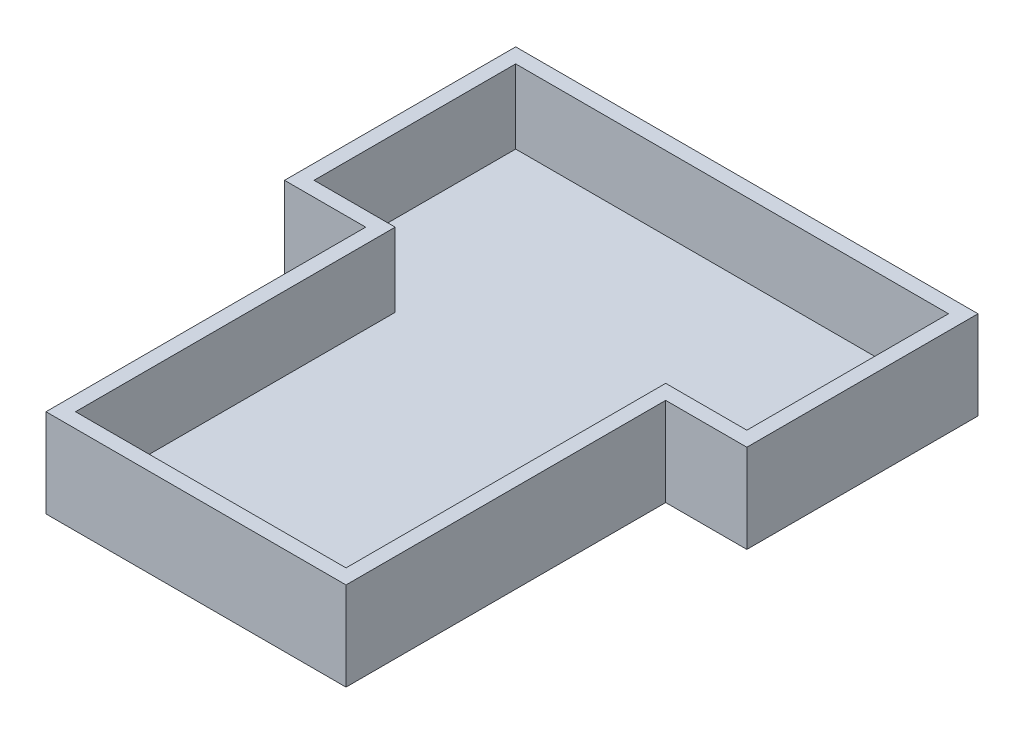
from build123d import *

# Parameters (mm, degrees)
BOSS_EXTRUDE1_DEPTH = 15
SHELL1_T            = 3


with BuildPart() as part:
    # Sketch1 → Boss-Extrude1 (new body)
    with BuildSketch(Plane(origin=(0, 0, 0), x_dir=(1, 0, 0), z_dir=(0, 1, 0))):
        Polygon((0, 0), (88, 0), (88, -41), (71.5, -41), (71.5, -106), (16.5, -106), (16.5, -41), (0, -41), align=None)
    extrude(amount=BOSS_EXTRUDE1_DEPTH)

    # Shell1
    shell1_openings = [part.faces().sort_by_distance(p)[0] for p in [
        (44, 15, 46.878254211),
    ]]
    offset(amount=SHELL1_T, openings=shell1_openings, kind=Kind.INTERSECTION)


solid = part.part
